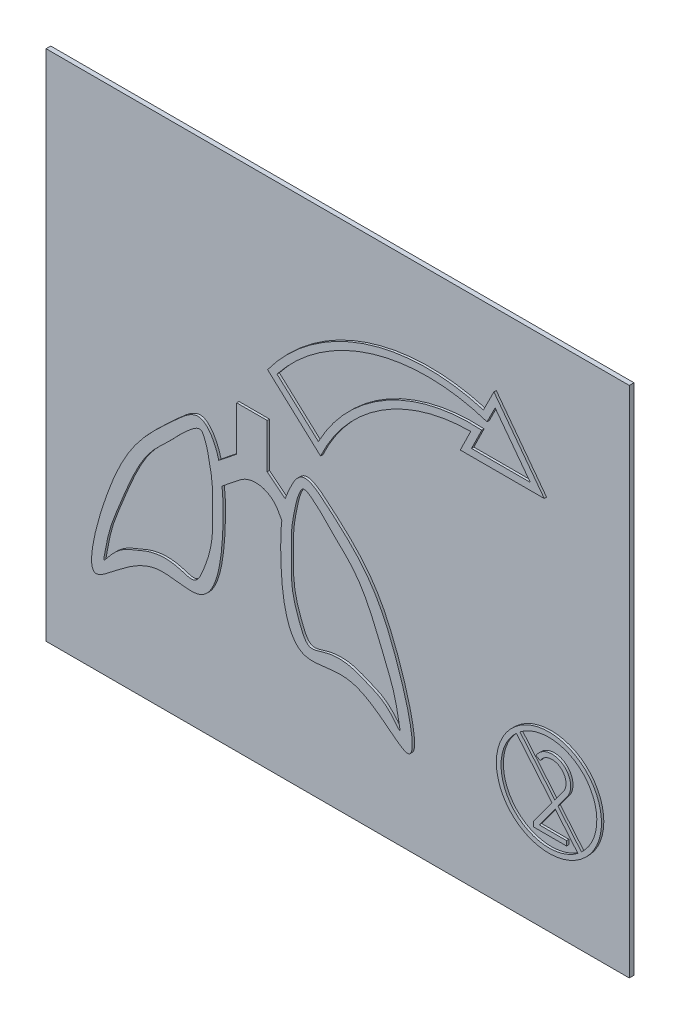
from build123d import *

# Parameters (mm, degrees)
ESQUISSE1_W      = 25
ESQUISSE1_H      = 22
EXTRUSION1_DEPTH = 0.2
EXTRUSION2_DEPTH = 0.1
EXTRUSION3_DEPTH = 0.1
ESQUISSE7_R      = 2.25329073
EXTRUSION4_DEPTH = 0.1


with BuildPart() as part:
    # Esquisse1 → Extrusion1 (new body)
    with BuildSketch(Plane.XY):
        with Locations((0, 1)):
            Rectangle(ESQUISSE1_W, ESQUISSE1_H)
    extrude(amount=EXTRUSION1_DEPTH)

    # Esquisse2 → Extrusion2 (add)
    with BuildSketch(Plane(origin=(-107.948096464, -44.966627708, 0.2), x_dir=(1, 0, 0), z_dir=(0, 0, 1))):
        with BuildLine():
            Line((102.949261002, 45.483428738), (103.720282646, 46.098149022))
            Line((103.720282646, 46.098149022), (103.720282646, 48.005059554))
            Line((103.720282646, 48.005059554), (105.02429837, 48.005059554))
            Line((105.02429837, 48.005059554), (105.02429837, 46.098149022))
            Line((105.02429837, 46.098149022), (105.795320014, 45.483428738))
            add(Edge.make_bspline(
                [(105.795320014, 45.483428738), (106.023083801, 46.05765588), (106.43294977, 47.090990317), (108.793076551, 45.120355487), (110.23196293, 43.600450018), (112.009783829, 37.008242786), (108.947504044, 40.739218695), (105.920268617, 39.380722256), (105.598051775, 42.455828729), (105.603511107, 43.917341833), (105.626504017, 44.426496972), (105.654439858, 44.601399102)],
                knots=[0, 0, 0, 0, 0.070214693, 0.126352892, 0.353003696, 0.536808852, 0.674978059, 0.772477531, 0.926637732, 0.974096476, 1, 1, 1, 1], degree=3))
            Line((105.654439858, 44.601399102), (105.491421153, 44.892198605))
            ThreePointArc((105.491421153, 44.892198605), (104.747997746, 45.430406434), (103.856475694, 45.212382446))
            Line((103.856475694, 45.212382446), (103.090141159, 44.601399102))
            add(Edge.make_bspline(
                [(102.949261002, 45.483428738), (102.842554052, 45.951523367), (102.269466321, 47.127955864), (99.999312676, 45.078448352), (98.497300793, 43.613766072), (96.737810547, 37.005890047), (99.795963609, 40.739501774), (102.826647222, 39.380862809), (103.13698992, 42.454582886), (103.149087763, 43.918400822), (103.108622435, 44.42524687), (103.090141159, 44.601399102)],
                knots=[0, 0, 0, 0, 0.070214693, 0.126352892, 0.353003696, 0.536808852, 0.674978059, 0.772477531, 0.926637732, 0.974096476, 1, 1, 1, 1], degree=3))
        make_face()
        with BuildLine():
            add(Edge.make_bspline(
                [(102.679572974, 42.677460231), (102.694322887, 42.964191792), (102.664769839, 43.530935243), (102.711694999, 44.412532989), (102.544711504, 45.272935951), (102.413158048, 45.880279322), (102.156415046, 46.347626706), (101.402745499, 45.782842057), (100.935363275, 45.20503274), (99.975928518, 44.364491485), (99.269226727, 43.159426219), (98.791542376, 41.923133934), (98.256344722, 40.633875473), (98.139988834, 40.017228507), (98.000232203, 39.247709869), (98.612941698, 40.07653207), (99.098958717, 40.245840024), (100.22125792, 40.73710692), (101.049977549, 40.738734163), (101.975749608, 40.361466955), (102.46108139, 41.446476935), (102.651852646, 42.138589706), (102.679572974, 42.677460231)],
                knots=[0, 0, 0, 0, 0.04767412, 0.089922149, 0.143249841, 0.187045871, 0.193766786, 0.222787718, 0.29066554, 0.34302156, 0.41986587, 0.515238388, 0.560384071, 0.637511532, 0.643694642, 0.656745907, 0.73601935, 0.772225825, 0.843596609, 0.873535603, 0.910403382, 1, 1, 1, 1], degree=3))
        make_face(mode=Mode.SUBTRACT)
        with BuildLine():
            add(Edge.make_bspline(
                [(106.065008042, 42.677460231), (106.05025813, 42.964191792), (106.079811177, 43.530935243), (106.032886018, 44.412532989), (106.199869512, 45.272935951), (106.331422968, 45.880279322), (106.58816597, 46.347626706), (107.341835518, 45.782842057), (107.809217742, 45.20503274), (108.768652498, 44.364491485), (109.475354289, 43.159426219), (109.95303864, 41.923133934), (110.488236295, 40.633875473), (110.604592182, 40.017228507), (110.744348813, 39.247709869), (110.131639318, 40.07653207), (109.645622299, 40.245840024), (108.523323096, 40.73710692), (107.694603467, 40.738734163), (106.768831409, 40.361466955), (106.283499627, 41.446476935), (106.09272837, 42.138589706), (106.065008042, 42.677460231)],
                knots=[0, 0, 0, 0, 0.04767412, 0.089922149, 0.143249841, 0.187045871, 0.193766786, 0.222787718, 0.29066554, 0.34302156, 0.41986587, 0.515238388, 0.560384071, 0.637511532, 0.643694642, 0.656745907, 0.73601935, 0.772225825, 0.843596609, 0.873535603, 0.910403382, 1, 1, 1, 1], degree=3))
        make_face(mode=Mode.SUBTRACT)
    extrude(amount=EXTRUSION2_DEPTH)

    # Esquisse5 → Extrusion3 (add)
    with BuildSketch(Plane(origin=(-95.584444445, -42.571313251, 0.2), x_dir=(1, 0, 0), z_dir=(0, 0, 1))):
        with BuildLine():
            Line((101.387355657, 49.56200431), (100.940431274, 48.650425764))
            Line((100.940431274, 48.650425764), (104.540431274, 48.650425764))
            Line((104.540431274, 48.650425764), (102.38241868, 51.531915247))
            Line((102.38241868, 51.531915247), (101.933097969, 50.63404825))
            ThreePointArc((101.933097969, 50.63404825), (96.81203399, 50.531508337), (92.680467071, 47.503973778))
            Line((92.680467071, 47.503973778), (94.951446765, 45.431042224))
            ThreePointArc((94.951446765, 45.431042224), (97.563556138, 48.440410818), (101.387355657, 49.56200431))
        make_face()
        with BuildLine():
            Line((93.084919507, 47.540978834), (94.858699346, 45.921887211))
            ThreePointArc((94.858699346, 45.921887211), (97.779486867, 48.919838532), (101.861090542, 49.846781522))
            Line((101.861090542, 49.846781522), (101.421629516, 48.950425764))
            Line((101.421629516, 48.950425764), (103.940948338, 48.950425764))
            Line((103.940948338, 48.950425764), (102.433384951, 50.963401988))
            Line((102.433384951, 50.963401988), (102.087364838, 50.271958143))
            ThreePointArc((102.087364838, 50.271958143), (97.155330732, 50.326602443), (93.084919507, 47.540978834))
        make_face(mode=Mode.SUBTRACT)
    extrude(amount=EXTRUSION3_DEPTH)

    # Esquisse7 → Extrusion4 (add)
    with BuildSketch(Plane(origin=(0, 0, 0.2), x_dir=(-1, 0, 0), z_dir=(0, 0, -1))):
        with Locations((-9.156073865, -4.739165592)):
            Circle(ESQUISSE7_R)
        with BuildLine():
            Line((-7.91441466, -3.103841391), (-9.410700922, -4.887045919))
            Line((-9.410700922, -4.887045919), (-9.753589967, -4.417000816))
            ThreePointArc((-9.753589967, -4.417000816), (-9.633073316, -3.549480021), (-8.77747537, -3.736746535))
            Line((-8.77747537, -3.736746535), (-8.605035964, -3.63543192))
            ThreePointArc((-8.605035964, -3.63543192), (-9.712780677, -3.362568683), (-9.95747235, -4.47687505))
            Line((-9.95747235, -4.47687505), (-9.543130883, -5.044869801))
            Line((-9.543130883, -5.044869801), (-10.550941959, -6.245932271))
            ThreePointArc((-10.550941959, -6.245932271), (-10.728985819, -3.419335751), (-7.91441466, -3.103841391))
        make_face(mode=Mode.SUBTRACT)
        with BuildLine():
            Line((-7.761205772, -3.232398913), (-9.289282883, -5.0534903))
            Line((-9.289282883, -5.0534903), (-8.49367238, -6.144142881))
            Line((-8.49367238, -6.144142881), (-8.49367238, -6.344142881))
            Line((-8.49367238, -6.344142881), (-9.91181719, -6.344142881))
            Line((-9.91181719, -6.344142881), (-9.91181719, -6.144142881))
            Line((-9.91181719, -6.144142881), (-8.741231888, -6.144142881))
            Line((-8.741231888, -6.144142881), (-9.421712844, -5.211314182))
            Line((-9.421712844, -5.211314182), (-10.39773307, -6.374489793))
            ThreePointArc((-10.39773307, -6.374489793), (-7.583161911, -6.058995432), (-7.761205772, -3.232398913))
        make_face(mode=Mode.SUBTRACT)
    extrude(amount=-EXTRUSION4_DEPTH)


solid = part.part
